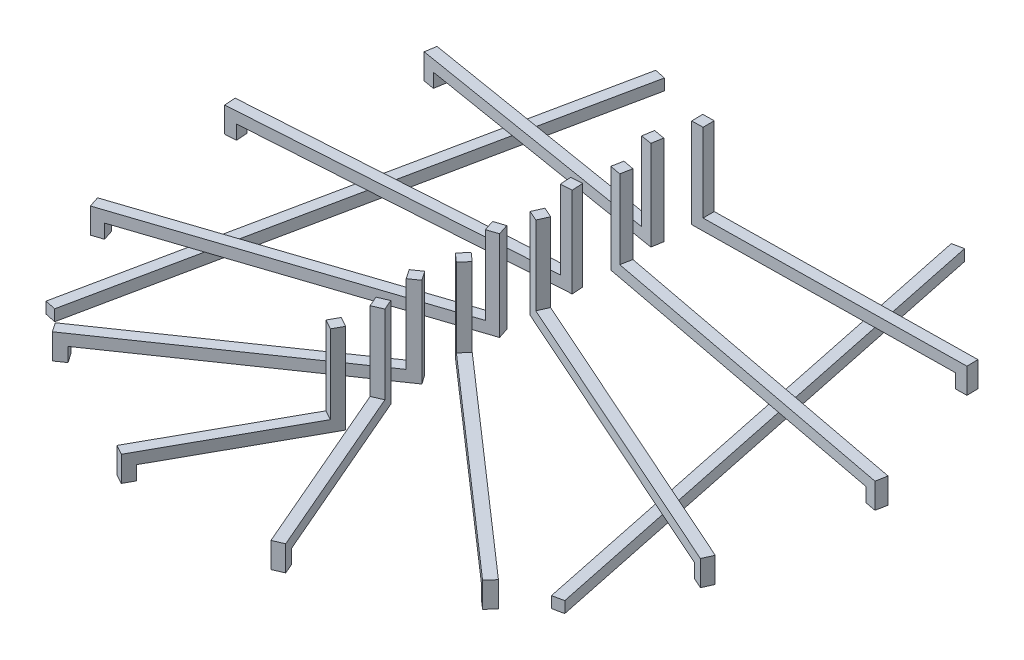
from build123d import *

# Parameters (mm, degrees)
EXTRUDE_THIN1_DEPTH             = 0.2
EXTRUDE_THIN1_2_DEPTH           = 0.2
EXTRUDE_THIN1_3_DEPTH           = 0.2
EXTRUDE_THIN1_4_DEPTH           = 0.2
EXTRUDE_THIN1_5_DEPTH           = 0.2
EXTRUDE_THIN1_6_DEPTH           = 0.2
EXTRUDE_THIN1_7_DEPTH           = 0.2
EXTRUDE_THIN1_8_DEPTH           = 0.2
EXTRUDE_THIN1_9_DEPTH           = 0.2
EXTRUDE_THIN1_10_DEPTH          = 0.2
BOSS_EXTRUDE1_DEPTH             = 1.4
BOSS_EXTRUDE3_DEPTH             = 0.25
BOSS_EXTRUDE3_DIRECTION_2_REACH = 10.19
BOSS_EXTRUDE4_DEPTH             = 0.2
BOSS_EXTRUDE4_2_DEPTH           = 0.2


with BuildPart() as part:
    # Sketch2 → Extrude-Thin1 (new body)
    with BuildSketch(Plane(origin=(0, 0, 0), x_dir=(1, 0, 0), z_dir=(0, 1, 0))):
        Polygon((-0.03148464, -0.160641292), (-5.407828036, -1.944063837), (-5.344858755, -2.133892364), (0.03148464, -0.350469819), align=None)
    extrude(amount=EXTRUDE_THIN1_DEPTH)



with BuildPart() as body_2:
    # Sketch2 → Extrude-Thin1 2 (new body)
    with BuildSketch(Plane(origin=(0, 0, 0), x_dir=(1, 0, 0), z_dir=(0, 1, 0))):
        Polygon((0.001402442, 3.100009835), (4.733559671, 3.166382128), (4.730754787, 3.366362459), (-0.001402442, 3.299990165), align=None)
    extrude(amount=EXTRUDE_THIN1_2_DEPTH)


with BuildPart() as body_3:
    # Sketch2 → Extrude-Thin1 3 (new body)
    with BuildSketch(Plane(origin=(0, 0, 0), x_dir=(1, 0, 0), z_dir=(0, 1, 0))):
        Polygon((-0.056722562, -1.595421534), (-3.869677847, -4.221580558), (-3.756232723, -4.386293046), (0.056722562, -1.760134022), align=None)
    extrude(amount=EXTRUDE_THIN1_3_DEPTH)


with BuildPart() as body_4:
    # Sketch2 → Extrude-Thin1 4 (new body)
    with BuildSketch(Plane(origin=(0, 0, 0), x_dir=(1, 0, 0), z_dir=(0, 1, 0))):
        Polygon((-0.091839415, -2.428455564), (1.284225654, -5.622482125), (1.467904485, -5.543348775), (0.091839415, -2.349322214), align=None)
    extrude(amount=EXTRUDE_THIN1_4_DEPTH)


with BuildPart() as body_5:
    # Sketch2 → Extrude-Thin1 5 (new body)
    with BuildSketch(Plane(origin=(0, 0, 0), x_dir=(1, 0, 0), z_dir=(0, 1, 0))):
        Polygon((-0.01866868, 1.679535829), (5.689407347, 0.594843963), (5.726744706, 0.79132786), (0.01866868, 1.876019726), align=None)
    extrude(amount=EXTRUDE_THIN1_5_DEPTH)


with BuildPart() as body_6:
    # Sketch2 → Extrude-Thin1 6 (new body)
    with BuildSketch(Plane(origin=(0, 0, 0), x_dir=(1, 0, 0), z_dir=(0, 1, 0))):
        Polygon((-0.040685453, 0.264206259), (5.335657943, -2.130327397), (5.417028848, -1.947628804), (0.040685453, 0.446904852), align=None)
    extrude(amount=EXTRUDE_THIN1_6_DEPTH)


with BuildPart() as body_7:
    # Sketch2 → Extrude-Thin1 7 (new body)
    with BuildSketch(Plane(origin=(0, 0, 0), x_dir=(1, 0, 0), z_dir=(0, 1, 0))):
        Polygon((-0.065860903, -1.041915198), (3.747094382, -4.379185334), (3.878816188, -4.22868827), (0.065860903, -0.891418135), align=None)
    extrude(amount=EXTRUDE_THIN1_7_DEPTH)


with BuildPart() as body_8:
    # Sketch2 → Extrude-Thin1 8 (new body)
    with BuildSketch(Plane(origin=(0, 0, 0), x_dir=(1, 0, 0), z_dir=(0, 1, 0))):
        Polygon((-0.087465517, -3.051525436), (-1.463530587, -5.534440887), (-1.288599553, -5.631390014), (0.087465517, -3.148474564), align=None)
    extrude(amount=EXTRUDE_THIN1_8_DEPTH)


with BuildPart() as body_9:
    # Sketch2 → Extrude-Thin1 9 (new body)
    with BuildSketch(Plane(origin=(0, 0, 0), x_dir=(1, 0, 0), z_dir=(0, 1, 0))):
        Polygon((0.016212428, 2.587565924), (-4.715944801, 3.365049328), (-4.748369657, 3.167695259), (-0.016212428, 2.390211854), align=None)
    extrude(amount=EXTRUDE_THIN1_9_DEPTH)


with BuildPart() as body_10:
    # Sketch2 → Extrude-Thin1 10 (new body)
    with BuildSketch(Plane(origin=(0, 0, 0), x_dir=(1, 0, 0), z_dir=(0, 1, 0))):
        Polygon((-0.006530803, 1.166453182), (-5.714606829, 0.792872427), (-5.701545223, 0.593299396), (0.006530803, 0.966880152), align=None)
    extrude(amount=EXTRUDE_THIN1_10_DEPTH)


with BuildPart() as part_1:
    add(part.part)

    add(body_2.part)  # Boss-Extrude1 merges body 2

    add(body_3.part)  # Boss-Extrude1 merges body 3

    add(body_4.part)  # Boss-Extrude1 merges body 4

    add(body_5.part)  # Boss-Extrude1 merges body 5

    add(body_6.part)  # Boss-Extrude1 merges body 6

    add(body_7.part)  # Boss-Extrude1 merges body 7

    add(body_8.part)  # Boss-Extrude1 merges body 8

    add(body_9.part)  # Boss-Extrude1 merges body 9

    add(body_10.part)  # Boss-Extrude1 merges body 10
    # Sketch3 → Boss-Extrude1 (add)
    with BuildSketch(Plane(origin=(0, 0.2, 0), x_dir=(1, 0, 0), z_dir=(0, 1, 0))):
        Polygon((-0.001402442, 3.299990165), (0.001402442, 3.100009835), (0.201382773, 3.102814719), (0.198577888, 3.30279505), align=None)
        Polygon((0.016212428, 2.587565924), (-0.181141642, 2.619990779), (-0.213566497, 2.42263671), (-0.016212428, 2.390211854), align=None)
        Polygon((0.01866868, 1.876019726), (-0.01866868, 1.679535829), (0.177815217, 1.64219847), (0.215152576, 1.838682367), align=None)
        Polygon((-0.006530803, 1.166453182), (0.006530803, 0.966880152), (-0.193042227, 0.953818545), (-0.206103834, 1.153391575), align=None)
        Polygon((0.040685453, 0.446904852), (-0.040685453, 0.264206259), (0.14201314, 0.182835354), (0.223384045, 0.365533947), align=None)
        Polygon((-0.03148464, -0.160641292), (0.03148464, -0.350469819), (-0.158343887, -0.4134391), (-0.221313167, -0.223610572), align=None)
        Polygon((0.065860903, -0.891418135), (-0.065860903, -1.041915198), (0.08463616, -1.173637004), (0.216357966, -1.023139941), align=None)
        Polygon((-0.056722562, -1.595421534), (0.056722562, -1.760134022), (-0.107989926, -1.873579146), (-0.22143505, -1.708866658), align=None)
        Polygon((0.091839415, -2.349322214), (-0.091839415, -2.428455564), (-0.012706065, -2.612134395), (0.170972766, -2.533001044), align=None)
        Polygon((-0.087465517, -3.051525436), (0.087465517, -3.148474564), (-0.00948361, -3.323405598), (-0.184414644, -3.226456471), align=None)
    extrude(amount=BOSS_EXTRUDE1_DEPTH)

    # Sketch4 → Boss-Extrude3 (add)
    with BuildSketch(Plane.XZ):
        Polygon((4.633569506, -3.164979686), (4.630764621, -3.364960017), (4.830744952, -3.367764901), (4.833549836, -3.167784571), align=None)
        Polygon((5.787649295, -0.576175284), (5.824986654, -0.77265918), (5.628502757, -0.809996539), (5.591165398, -0.613512643), align=None)
        Polygon((5.427007239, 2.171012849), (5.508378144, 1.988314257), (5.325679552, 1.906943352), (5.244308646, 2.089641944), align=None)
        Polygon((3.822342914, 4.445046236), (3.954064719, 4.294549173), (3.803567656, 4.162827368), (3.671845851, 4.313324431), align=None)
        Polygon((1.323792329, 5.714321541), (1.50747116, 5.63518819), (1.42833781, 5.45150936), (1.244658979, 5.53064271), align=None)
        Polygon((-1.51200515, 5.621906404), (-1.337074116, 5.718855531), (-1.240124989, 5.543924497), (-1.415056023, 5.446975369), align=None)
        Polygon((-3.952034091, 4.27830312), (-3.838588967, 4.443015608), (-3.673876479, 4.329570484), (-3.787321603, 4.164857996), align=None)
        Polygon((-5.439773019, 2.165377004), (-5.502742299, 1.975548477), (-5.312913772, 1.912579197), (-5.249944492, 2.102407724), align=None)
        Polygon((-5.814393345, -0.786341623), (-5.801331738, -0.586768593), (-5.601758708, -0.5998302), (-5.614820314, -0.79940323), align=None)
        Polygon((-4.847046691, -3.183907687), (-4.814621836, -3.381261756), (-4.617267766, -3.348836901), (-4.649692622, -3.151482831), align=None)
    extrude(amount=BOSS_EXTRUDE3_DEPTH)

    # Boss-Extrude3 direction 2: up to this face of the body (flat: up to its plane)
    boss_extrude3_direction_2_end = Plane(part_1.part.faces().sort_by_distance((2.46606878, 0.2, -3.234588589))[0])
    # Sketch4 → Boss-Extrude3 direction 2 (add, up to the picked face)
    with BuildSketch(Plane.XZ, mode=Mode.PRIVATE) as boss_extrude3_direction_2_sk1:
        Polygon((4.633569506, -3.164979686), (4.630764621, -3.364960017), (4.830744952, -3.367764901), (4.833549836, -3.167784571), align=None)
    boss_extrude3_direction_2_tool1 = split(extrude(boss_extrude3_direction_2_sk1.sketch, amount=-BOSS_EXTRUDE3_DIRECTION_2_REACH, mode=Mode.PRIVATE), bisect_by=boss_extrude3_direction_2_end, keep=Keep.BOTH, mode=Mode.PRIVATE)
    # Sketch4 → Boss-Extrude3 direction 2 (add, up to the picked face)
    with BuildSketch(Plane.XZ, mode=Mode.PRIVATE) as boss_extrude3_direction_2_sk2:
        Polygon((5.787649295, -0.576175284), (5.824986654, -0.77265918), (5.628502757, -0.809996539), (5.591165398, -0.613512643), align=None)
    boss_extrude3_direction_2_tool2 = split(extrude(boss_extrude3_direction_2_sk2.sketch, amount=-BOSS_EXTRUDE3_DIRECTION_2_REACH, mode=Mode.PRIVATE), bisect_by=boss_extrude3_direction_2_end, keep=Keep.BOTH, mode=Mode.PRIVATE)
    # Sketch4 → Boss-Extrude3 direction 2 (add, up to the picked face)
    with BuildSketch(Plane.XZ, mode=Mode.PRIVATE) as boss_extrude3_direction_2_sk3:
        Polygon((5.427007239, 2.171012849), (5.508378144, 1.988314257), (5.325679552, 1.906943352), (5.244308646, 2.089641944), align=None)
    boss_extrude3_direction_2_tool3 = split(extrude(boss_extrude3_direction_2_sk3.sketch, amount=-BOSS_EXTRUDE3_DIRECTION_2_REACH, mode=Mode.PRIVATE), bisect_by=boss_extrude3_direction_2_end, keep=Keep.BOTH, mode=Mode.PRIVATE)
    # Sketch4 → Boss-Extrude3 direction 2 (add, up to the picked face)
    with BuildSketch(Plane.XZ, mode=Mode.PRIVATE) as boss_extrude3_direction_2_sk4:
        Polygon((3.822342914, 4.445046236), (3.954064719, 4.294549173), (3.803567656, 4.162827368), (3.671845851, 4.313324431), align=None)
    boss_extrude3_direction_2_tool4 = split(extrude(boss_extrude3_direction_2_sk4.sketch, amount=-BOSS_EXTRUDE3_DIRECTION_2_REACH, mode=Mode.PRIVATE), bisect_by=boss_extrude3_direction_2_end, keep=Keep.BOTH, mode=Mode.PRIVATE)
    # Sketch4 → Boss-Extrude3 direction 2 (add, up to the picked face)
    with BuildSketch(Plane.XZ, mode=Mode.PRIVATE) as boss_extrude3_direction_2_sk5:
        Polygon((1.323792329, 5.714321541), (1.50747116, 5.63518819), (1.42833781, 5.45150936), (1.244658979, 5.53064271), align=None)
    boss_extrude3_direction_2_tool5 = split(extrude(boss_extrude3_direction_2_sk5.sketch, amount=-BOSS_EXTRUDE3_DIRECTION_2_REACH, mode=Mode.PRIVATE), bisect_by=boss_extrude3_direction_2_end, keep=Keep.BOTH, mode=Mode.PRIVATE)
    # Sketch4 → Boss-Extrude3 direction 2 (add, up to the picked face)
    with BuildSketch(Plane.XZ, mode=Mode.PRIVATE) as boss_extrude3_direction_2_sk6:
        Polygon((-1.51200515, 5.621906404), (-1.337074116, 5.718855531), (-1.240124989, 5.543924497), (-1.415056023, 5.446975369), align=None)
    boss_extrude3_direction_2_tool6 = split(extrude(boss_extrude3_direction_2_sk6.sketch, amount=-BOSS_EXTRUDE3_DIRECTION_2_REACH, mode=Mode.PRIVATE), bisect_by=boss_extrude3_direction_2_end, keep=Keep.BOTH, mode=Mode.PRIVATE)
    # Sketch4 → Boss-Extrude3 direction 2 (add, up to the picked face)
    with BuildSketch(Plane.XZ, mode=Mode.PRIVATE) as boss_extrude3_direction_2_sk7:
        Polygon((-3.952034091, 4.27830312), (-3.838588967, 4.443015608), (-3.673876479, 4.329570484), (-3.787321603, 4.164857996), align=None)
    boss_extrude3_direction_2_tool7 = split(extrude(boss_extrude3_direction_2_sk7.sketch, amount=-BOSS_EXTRUDE3_DIRECTION_2_REACH, mode=Mode.PRIVATE), bisect_by=boss_extrude3_direction_2_end, keep=Keep.BOTH, mode=Mode.PRIVATE)
    # Sketch4 → Boss-Extrude3 direction 2 (add, up to the picked face)
    with BuildSketch(Plane.XZ, mode=Mode.PRIVATE) as boss_extrude3_direction_2_sk8:
        Polygon((-5.439773019, 2.165377004), (-5.502742299, 1.975548477), (-5.312913772, 1.912579197), (-5.249944492, 2.102407724), align=None)
    boss_extrude3_direction_2_tool8 = split(extrude(boss_extrude3_direction_2_sk8.sketch, amount=-BOSS_EXTRUDE3_DIRECTION_2_REACH, mode=Mode.PRIVATE), bisect_by=boss_extrude3_direction_2_end, keep=Keep.BOTH, mode=Mode.PRIVATE)
    # Sketch4 → Boss-Extrude3 direction 2 (add, up to the picked face)
    with BuildSketch(Plane.XZ, mode=Mode.PRIVATE) as boss_extrude3_direction_2_sk9:
        Polygon((-5.814393345, -0.786341623), (-5.801331738, -0.586768593), (-5.601758708, -0.5998302), (-5.614820314, -0.79940323), align=None)
    boss_extrude3_direction_2_tool9 = split(extrude(boss_extrude3_direction_2_sk9.sketch, amount=-BOSS_EXTRUDE3_DIRECTION_2_REACH, mode=Mode.PRIVATE), bisect_by=boss_extrude3_direction_2_end, keep=Keep.BOTH, mode=Mode.PRIVATE)
    # Sketch4 → Boss-Extrude3 direction 2 (add, up to the picked face)
    with BuildSketch(Plane.XZ, mode=Mode.PRIVATE) as boss_extrude3_direction_2_sk10:
        Polygon((-4.847046691, -3.183907687), (-4.814621836, -3.381261756), (-4.617267766, -3.348836901), (-4.649692622, -3.151482831), align=None)
    boss_extrude3_direction_2_tool10 = split(extrude(boss_extrude3_direction_2_sk10.sketch, amount=-BOSS_EXTRUDE3_DIRECTION_2_REACH, mode=Mode.PRIVATE), bisect_by=boss_extrude3_direction_2_end, keep=Keep.BOTH, mode=Mode.PRIVATE)
    add(boss_extrude3_direction_2_tool1.solids().sort_by(Axis((4.732157, 0, -3.266372), (0, 1, 0)))[0])
    add(boss_extrude3_direction_2_tool2.solids().sort_by(Axis((5.708076, 0, -0.693086), (0, 1, 0)))[0])
    add(boss_extrude3_direction_2_tool3.solids().sort_by(Axis((5.376343, 0, 2.038978), (0, 1, 0)))[0])
    add(boss_extrude3_direction_2_tool4.solids().sort_by(Axis((3.812955, 0, 4.303937), (0, 1, 0)))[0])
    add(boss_extrude3_direction_2_tool5.solids().sort_by(Axis((1.376065, 0, 5.582915), (0, 1, 0)))[0])
    add(boss_extrude3_direction_2_tool6.solids().sort_by(Axis((-1.376065, 0, 5.582915), (0, 1, 0)))[0])
    add(boss_extrude3_direction_2_tool7.solids().sort_by(Axis((-3.812955, 0, 4.303937), (0, 1, 0)))[0])
    add(boss_extrude3_direction_2_tool8.solids().sort_by(Axis((-5.376343, 0, 2.038978), (0, 1, 0)))[0])
    add(boss_extrude3_direction_2_tool9.solids().sort_by(Axis((-5.708076, 0, -0.693086), (0, 1, 0)))[0])
    add(boss_extrude3_direction_2_tool10.solids().sort_by(Axis((-4.732157, 0, -3.266372), (0, 1, 0)))[0])


with BuildPart() as body_2_2:
    # Sketch5 → Boss-Extrude4 (new body)
    with BuildSketch(Plane(origin=(0, -0.25, 0), x_dir=(1, 0, 0), z_dir=(0, 1, 0))):
        Polygon((4.422449747, -3.818262244), (2.553895996, 5.168922401), (2.749708492, 5.209634391), (4.618262244, -3.777550253), align=None)
    extrude(amount=BOSS_EXTRUDE4_DEPTH)


with BuildPart() as body_3_2:
    # Sketch5 → Boss-Extrude4 2 (new body)
    with BuildSketch(Plane(origin=(0, -0.25, 0), x_dir=(1, 0, 0), z_dir=(0, 1, 0))):
        Polygon((-4.618262244, -3.777550253), (-2.749708492, 5.209634391), (-2.553895996, 5.168922401), (-4.422449747, -3.818262244), align=None)
    extrude(amount=BOSS_EXTRUDE4_2_DEPTH)


solid = Compound([part_1.part, body_2_2.part, body_3_2.part])
